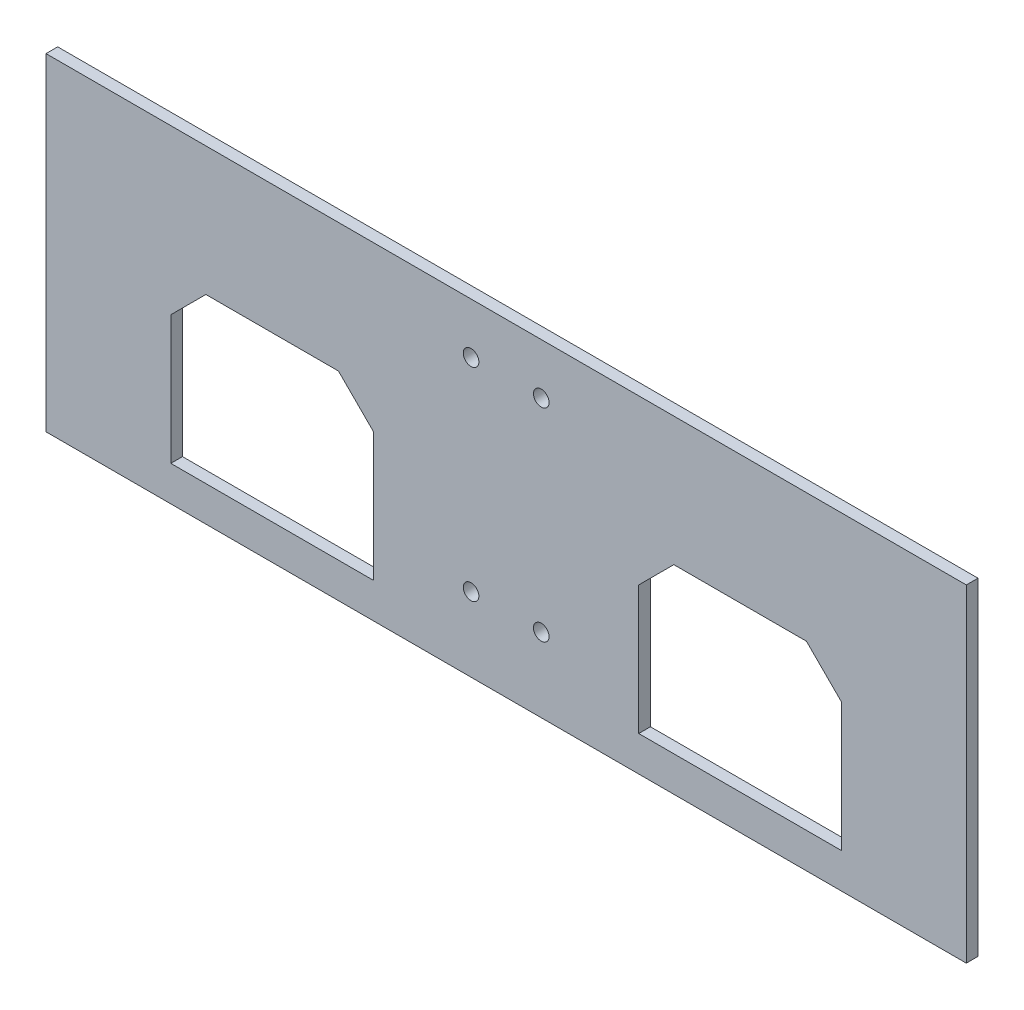
from build123d import *

# Parameters (mm, degrees)
ESQUISSE1_W             = 236
ESQUISSE1_H             = 78
BOSS_EXTRU_1_DEPTH      = 3
ENL_V_MAT_EXTRU_1_REACH = 126.314
ESQUISSE2_R             = 2
ESQUISSE3_W             = 236
ESQUISSE3_H             = 6
BOSS_EXTRU_2_DEPTH      = 3
ENL_V_MAT_EXTRU_2_REACH = 128.325


with BuildPart() as part:
    # Esquisse1 → Boss.-Extru.1 (new body)
    with BuildSketch(Plane.XY):
        Rectangle(ESQUISSE1_W, ESQUISSE1_H)
    extrude(amount=BOSS_EXTRU_1_DEPTH)

    # Esquisse2 → Enlèv. mat.-Extru.1 (cut, up to next)
    with BuildSketch(Plane.XY.offset(3), mode=Mode.PRIVATE) as enl_v_mat_extru_1_sk1:
        with Locations((9, -26)):
            Circle(ESQUISSE2_R)
    enl_v_mat_extru_1_tool1 = extrude(enl_v_mat_extru_1_sk1.sketch, amount=-ENL_V_MAT_EXTRU_1_REACH, mode=Mode.PRIVATE) & part.part
    # Esquisse2 → Enlèv. mat.-Extru.1 (cut, up to next)
    with BuildSketch(Plane.XY.offset(3), mode=Mode.PRIVATE) as enl_v_mat_extru_1_sk2:
        with Locations((-9, -26)):
            Circle(ESQUISSE2_R)
    enl_v_mat_extru_1_tool2 = extrude(enl_v_mat_extru_1_sk2.sketch, amount=-ENL_V_MAT_EXTRU_1_REACH, mode=Mode.PRIVATE) & part.part
    enl_v_mat_extru_1_1 = enl_v_mat_extru_1_tool1.solids().sort_by_distance((9, -26, 3))[0]
    add(enl_v_mat_extru_1_1, mode=Mode.SUBTRACT)
    enl_v_mat_extru_1_2 = enl_v_mat_extru_1_tool2.solids().sort_by_distance((-9, -26, 3))[0]
    add(enl_v_mat_extru_1_2, mode=Mode.SUBTRACT)
    enl_v_mat_extru_1 = enl_v_mat_extru_1_1 + enl_v_mat_extru_1_2  # Enlèv. mat.-Extru.1 as one shape, for the pattern or mirror that repeats it

    # Symétrie1: Enlèv. mat.-Extru.1 across plane
    add(enl_v_mat_extru_1.mirror(Plane.ZX), mode=Mode.SUBTRACT)

    # Esquisse3 → Boss.-Extru.2 (add)
    with BuildSketch(Plane.XY.offset(3)):
        with Locations((0, -42)):
            Rectangle(ESQUISSE3_W, ESQUISSE3_H)
    extrude(amount=-BOSS_EXTRU_2_DEPTH)

    # Esquisse4 → Enlèv. mat.-Extru.2 (cut, up to next)
    with BuildSketch(Plane.XY.offset(3), mode=Mode.PRIVATE) as enl_v_mat_extru_2_sk1:
        Polygon((34, -36), (34, -3), (43, 6), (77, 6), (86, -3), (86, -36), align=None)
    enl_v_mat_extru_2_tool1 = extrude(enl_v_mat_extru_2_sk1.sketch, amount=-ENL_V_MAT_EXTRU_2_REACH, mode=Mode.PRIVATE) & part.part
    # Esquisse4 → Enlèv. mat.-Extru.2 (cut, up to next)
    with BuildSketch(Plane.XY.offset(3), mode=Mode.PRIVATE) as enl_v_mat_extru_2_sk2:
        Polygon((-86, -3), (-77, 6), (-43, 6), (-34, -3), (-34, -36), (-86, -36), align=None)
    enl_v_mat_extru_2_tool2 = extrude(enl_v_mat_extru_2_sk2.sketch, amount=-ENL_V_MAT_EXTRU_2_REACH, mode=Mode.PRIVATE) & part.part
    add(enl_v_mat_extru_2_tool1.solids().sort_by_distance((60, -15.693295, 3))[0], mode=Mode.SUBTRACT)
    add(enl_v_mat_extru_2_tool2.solids().sort_by_distance((-60, -15.693295, 3))[0], mode=Mode.SUBTRACT)


solid = part.part
